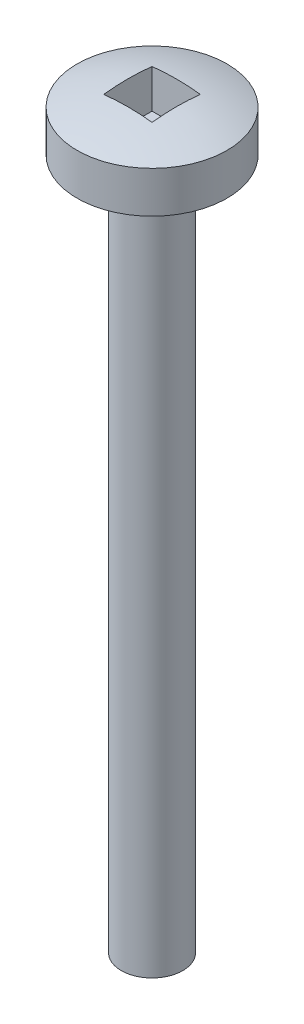
from build123d import *

# Parameters (mm, degrees)
SKETCH1_R            = 1.1303
THREADS_DEPTH        = 25.4
SKETCH2_R            = 2.7559
HEAD_DEPTH           = 1.524
HEADDOME_FACE_RADIUS = 2.7559
HEADDOME_HEIGHT      = 0.508
SKETCH3_W            = 1.778
SKETCH3_H            = 1.778
DRIVER_DEPTH         = 1.524


with BuildPart() as part:
    # Sketch1 → threads (new body)
    with BuildSketch(Plane(origin=(0, 0, 0), x_dir=(1, 0, 0), z_dir=(0, 1, 0))):
        with Locations(Location((0, 0, 0), (0, 0, 270))):
            Circle(SKETCH1_R)
    extrude(amount=-THREADS_DEPTH)

    # Sketch2 → Head (add)
    with BuildSketch(Plane(origin=(0, 0, 0), x_dir=(1, 0, 0), z_dir=(0, 1, 0))):
        with Locations(Location((0, 0, 0), (0, 0, 90))):
            Circle(SKETCH2_R)
    extrude(amount=HEAD_DEPTH)

    # HeadDome: a dome of height H over a round flat face of radius A is a cap of a sphere of radius (A * A + H * H) / (2 * H)
    headdome_r = (HEADDOME_FACE_RADIUS * HEADDOME_FACE_RADIUS + HEADDOME_HEIGHT * HEADDOME_HEIGHT) / (2 * HEADDOME_HEIGHT)
    headdome_base = Plane((0, 1.524, 0), z_dir=(0, 1, 0))
    with Locations(headdome_base.offset(HEADDOME_HEIGHT - headdome_r)):
        headdome_ball = Sphere(headdome_r, mode=Mode.PRIVATE)
    add(split(headdome_ball, bisect_by=headdome_base, keep=Keep.TOP, mode=Mode.PRIVATE))

    # Sketch3 → Driver (cut)
    with BuildSketch(Plane(origin=(0, 2.032, 0), x_dir=(1, 0, 0), z_dir=(0, 1, 0))):
        Rectangle(SKETCH3_W, SKETCH3_H)
    extrude(amount=-DRIVER_DEPTH, mode=Mode.SUBTRACT)


solid = part.part
